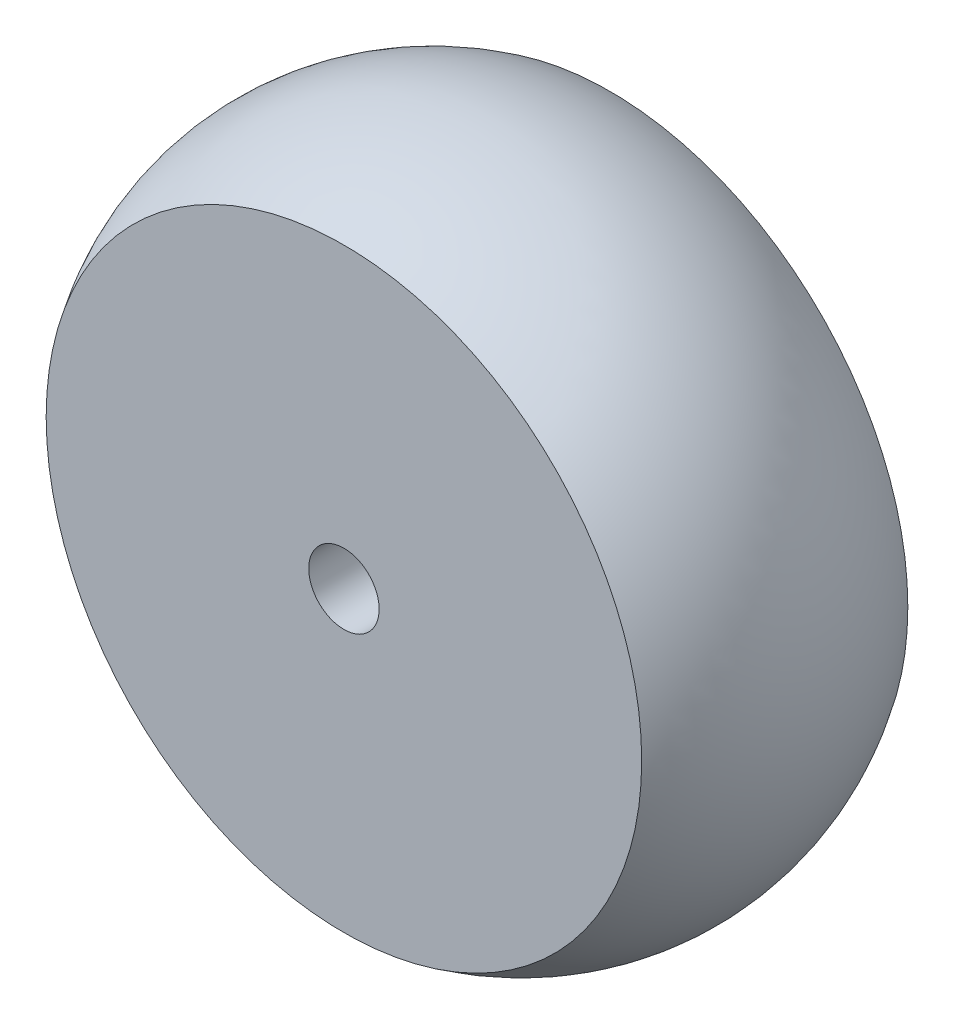
from build123d import *


with BuildPart() as part:
    # Sketch1 → Revolve1 (revolve)
    with BuildSketch(Plane(origin=(0, 0, 0), x_dir=(0, 0, -1), z_dir=(1, 0, 0)), mode=Mode.PRIVATE) as revolve1_sk:
        with BuildLine():
            Line((0, 1.5875), (0, 13.42676048))
            ThreePointArc((0, 13.42676048), (6, 15.25), (12, 13.42676048))
            Line((12, 13.42676048), (12, 1.5875))
            Line((12, 1.5875), (0, 1.5875))
        make_face()
    revolve(revolve1_sk.sketch.rotate(Axis((0, 0, 0), (0, 0, -1)), 90), axis=Axis((0, 0, 0), (0, 0, -1)))


solid = part.part
